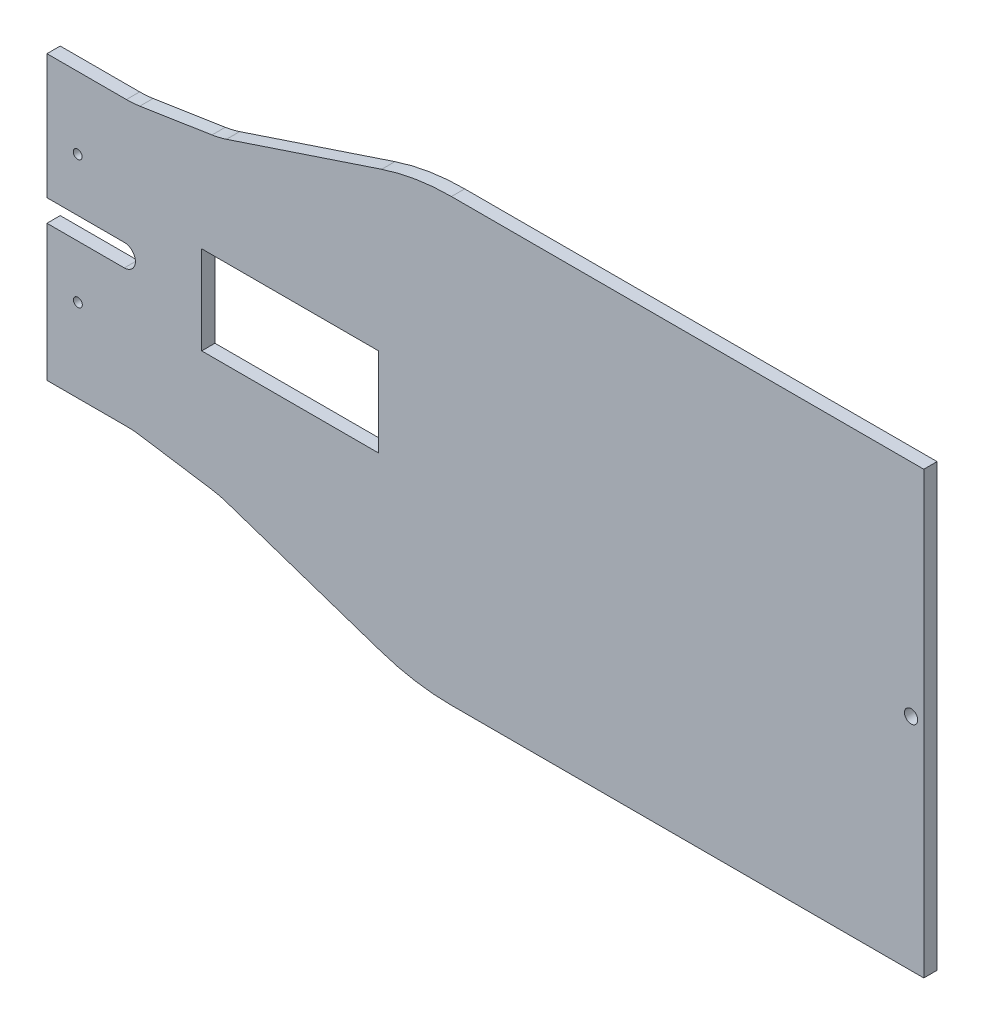
from build123d import *

# Parameters (mm, degrees)
RESSALTO_EXTRUS_O2_DEPTH = 3
FILETE4_R                = 50
FILETE6_R                = 20
ESBO_O3_R                = 1.000396488
CORTE_EXTRUS_O1_DEPTH    = 3
ESBO_O4_R                = 2.5
CORTE_EXTRUS_O3_DEPTH    = 3
ESBO_O5_R                = 1
CORTE_EXTRUS_O4_DEPTH    = 3
ESBO_O6_W                = 28
ESBO_O6_H                = 99.656129788
CORTE_EXTRUS_O5_DEPTH    = 10
ESBO_O7_R                = 1.5
CORTE_EXTRUS_O6_DEPTH    = 10
ESBO_O8_W                = 40
ESBO_O8_H                = 20
CORTE_EXTRUS_O7_DEPTH    = 10


with BuildPart() as part:
    # Esboço1 → Ressalto-extrusão2 (new body)
    with BuildSketch(Plane.XY):
        Polygon((130.267029072, 60.684036759), (130.267029072, -38.972093029), (-12.814839489, -38.972093029), (-57.051670623, -24.075187779), (-76.551670623, -21.075187779), (-96.051670623, -21.075187779), (-96.051670623, -19.075187779), (-96.051670623, 10.924812221), (-96.051670623, 40.924812221), (-96.051670623, 42.924812221), (-76.551670623, 42.924812221), (-57.051670623, 45.924812221), (-12.66677951, 60.684036759), align=None)
    extrude(amount=RESSALTO_EXTRUS_O2_DEPTH)

    # Filete4
    filete4_edges = [part.edges().sort_by_distance(p)[0] for p in [
        (-12.814839489, -38.972093029, 1.5),
        (-12.66677951, 60.684036759, 1.5),
    ]]
    fillet(filete4_edges, radius=FILETE4_R)

    # Filete6
    filete6_edges = [part.edges().sort_by_distance(p)[0] for p in [
        (-57.051670623, -24.075187779, 1.5),
        (-76.551670623, -21.075187779, 1.5),
        (-76.551670623, 42.924812221, 1.5),
        (-57.051670623, 45.924812221, 1.5),
    ]]
    fillet(filete6_edges, radius=FILETE6_R)

    # Esboço3 → Corte-extrusão1 (cut)
    with BuildSketch(Plane.XY.offset(3)):
        with Locations((127.267029072, 10.855971865)):
            Circle(ESBO_O3_R)
    extrude(amount=-CORTE_EXTRUS_O1_DEPTH, mode=Mode.SUBTRACT)

    # Esboço4 → Corte-extrusão3 (cut)
    with BuildSketch(Plane.XY.offset(3)):
        with BuildLine():
            Line((-78.551670623, 14.705809502), (-96.051670623, 14.705809502))
            Line((-96.051670623, 14.705809502), (-96.051670623, 12.205809502))
            Line((-96.051670623, 12.205809502), (-81.051670623, 12.205809502))
            ThreePointArc((-81.051670623, 12.205809502), (-80.319437576, 13.973576455), (-78.551670623, 14.705809502))
        make_face()
        with BuildLine():
            Line((-81.051670623, 12.205809502), (-96.051670623, 12.205809502))
            Line((-96.051670623, 12.205809502), (-96.051670623, 9.705809502))
            Line((-96.051670623, 9.705809502), (-78.551670623, 9.705809502))
            ThreePointArc((-78.551670623, 9.705809502), (-80.319437576, 10.438042549), (-81.051670623, 12.205809502))
        make_face()
        with Locations((-78.551670623, 12.205809502)):
            Circle(ESBO_O4_R)
    extrude(amount=-CORTE_EXTRUS_O3_DEPTH, mode=Mode.SUBTRACT)

    # Esboço5 → Corte-extrusão4 (cut)
    with BuildSketch(Plane.XY.offset(3)):
        with Locations((-89.059378868, -2.294160789)):
            Circle(ESBO_O5_R)
        with Locations((-89.102120748, 26.704536083)):
            Circle(ESBO_O5_R)
    extrude(amount=-CORTE_EXTRUS_O4_DEPTH, mode=Mode.SUBTRACT)

    # Esboço6 → Corte-extrusão5 (cut)
    with BuildSketch(Plane.XY.offset(3)):
        with Locations((116.267029072, 10.855971865)):
            Rectangle(ESBO_O6_W, ESBO_O6_H)
    extrude(amount=-CORTE_EXTRUS_O5_DEPTH, mode=Mode.SUBTRACT)

    # Esboço7 → Corte-extrusão6 (cut)
    with BuildSketch(Plane.XY.offset(3)):
        with Locations((99.400721929, 10.855971865)):
            Circle(ESBO_O7_R)
    extrude(amount=-CORTE_EXTRUS_O6_DEPTH, mode=Mode.SUBTRACT)

    # Esboço8 → Corte-extrusão7 (cut)
    with BuildSketch(Plane.XY.offset(3)):
        with Locations((-41.051670623, 12.205809502)):
            Rectangle(ESBO_O8_W, ESBO_O8_H)
    extrude(amount=-CORTE_EXTRUS_O7_DEPTH, mode=Mode.SUBTRACT)


solid = part.part
